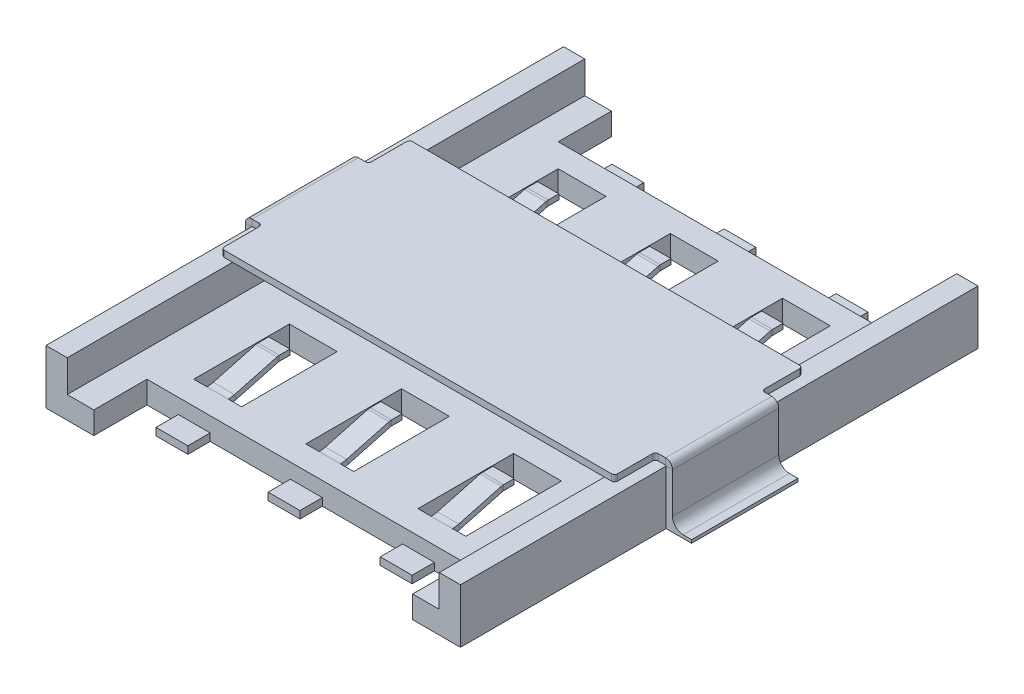
from build123d import *

# Parameters (mm, degrees)
SKETCH1_W           = 9.906
SKETCH1_H           = 12.3698
BOSS_EXTRUDE1_DEPTH = 0.5334
SKETCH2_W           = 0.508
SKETCH2_H           = 12.3698
BOSS_EXTRUDE2_DEPTH = 0.762
CUT_EXTRUDE1_REACH  = 9.96
SKETCH3_W           = 7.62
SKETCH3_H           = 1.27
CUT_EXTRUDE2_REACH  = 9.96
SKETCH4_W           = 1.143
SKETCH4_H           = 2.286
SKETCH5_W           = 0.1524
SKETCH5_H           = 2.54
SKETCH7_W           = 9.398
SKETCH7_H           = 0.9779
BOSS_EXTRUDE3_DEPTH = 0.1524
FILLET1_R           = 0.0762
SKETCH8_W           = 0.508
SKETCH8_H           = 0.127
SKETCH10_W          = 0.508
SKETCH10_H          = 0.127
SKETCH11_W          = 0.762
SKETCH11_H          = 0.5334
BOSS_EXTRUDE4_DEPTH = 0.1778
SKETCH12_W          = 0.4572
SKETCH12_H          = 2.54
BOSS_EXTRUDE5_DEPTH = 0.0762
FILLET2_R           = 0.254


with BuildPart() as part:
    # Sketch1 → Boss-Extrude1 (new body)
    with BuildSketch(Plane(origin=(0, 0, 0), x_dir=(1, 0, 0), z_dir=(0, 1, 0))):
        Rectangle(SKETCH1_W, SKETCH1_H)
    extrude(amount=BOSS_EXTRUDE1_DEPTH)

    # Sketch2 → Boss-Extrude2 (add)
    with BuildSketch(Plane(origin=(0, 0.5334, 0), x_dir=(1, 0, 0), z_dir=(0, 1, 0))):
        with Locations((-4.699, 0)):
            Rectangle(SKETCH2_W, SKETCH2_H)
        with Locations((4.699, 0)):
            Rectangle(SKETCH2_W, SKETCH2_H)
    extrude(amount=BOSS_EXTRUDE2_DEPTH)

    # Sketch3 → Cut-Extrude1 (cut, up to next)
    with BuildSketch(Plane(origin=(0, 0.5334, 0), x_dir=(1, 0, 0), z_dir=(0, 1, 0)), mode=Mode.PRIVATE) as cut_extrude1_sk1:
        with Locations((0, 5.5499)):
            Rectangle(SKETCH3_W, SKETCH3_H)
    cut_extrude1_tool1 = extrude(cut_extrude1_sk1.sketch, amount=-CUT_EXTRUDE1_REACH, mode=Mode.PRIVATE) & part.part
    # Sketch3 → Cut-Extrude1 (cut, up to next)
    with BuildSketch(Plane(origin=(0, 0.5334, 0), x_dir=(1, 0, 0), z_dir=(0, 1, 0)), mode=Mode.PRIVATE) as cut_extrude1_sk2:
        with Locations((0, -5.5499)):
            Rectangle(SKETCH3_W, SKETCH3_H)
    cut_extrude1_tool2 = extrude(cut_extrude1_sk2.sketch, amount=-CUT_EXTRUDE1_REACH, mode=Mode.PRIVATE) & part.part
    add(cut_extrude1_tool1.solids().sort_by_distance((0, 0.5334, -5.5499))[0], mode=Mode.SUBTRACT)
    add(cut_extrude1_tool2.solids().sort_by_distance((0, 0.5334, 5.5499))[0], mode=Mode.SUBTRACT)

    # Sketch4 → Cut-Extrude2 (cut, up to next)
    with BuildSketch(Plane(origin=(0, 0.5334, 0), x_dir=(1, 0, 0), z_dir=(0, 1, 0)), mode=Mode.PRIVATE) as cut_extrude2_sk1:
        with Locations((-2.6797, 3.2131)):
            Rectangle(SKETCH4_W, SKETCH4_H)
    cut_extrude2_tool1 = extrude(cut_extrude2_sk1.sketch, amount=-CUT_EXTRUDE2_REACH, mode=Mode.PRIVATE) & part.part
    # Sketch4 → Cut-Extrude2 (cut, up to next)
    with BuildSketch(Plane(origin=(0, 0.5334, 0), x_dir=(1, 0, 0), z_dir=(0, 1, 0)), mode=Mode.PRIVATE) as cut_extrude2_sk2:
        with Locations((0, 3.2131)):
            Rectangle(SKETCH4_W, SKETCH4_H)
    cut_extrude2_tool2 = extrude(cut_extrude2_sk2.sketch, amount=-CUT_EXTRUDE2_REACH, mode=Mode.PRIVATE) & part.part
    # Sketch4 → Cut-Extrude2 (cut, up to next)
    with BuildSketch(Plane(origin=(0, 0.5334, 0), x_dir=(1, 0, 0), z_dir=(0, 1, 0)), mode=Mode.PRIVATE) as cut_extrude2_sk3:
        with Locations((2.6797, 3.2131)):
            Rectangle(SKETCH4_W, SKETCH4_H)
    cut_extrude2_tool3 = extrude(cut_extrude2_sk3.sketch, amount=-CUT_EXTRUDE2_REACH, mode=Mode.PRIVATE) & part.part
    # Sketch4 → Cut-Extrude2 (cut, up to next)
    with BuildSketch(Plane(origin=(0, 0.5334, 0), x_dir=(1, 0, 0), z_dir=(0, 1, 0)), mode=Mode.PRIVATE) as cut_extrude2_sk4:
        with Locations((2.6797, -3.2131)):
            Rectangle(SKETCH4_W, SKETCH4_H)
    cut_extrude2_tool4 = extrude(cut_extrude2_sk4.sketch, amount=-CUT_EXTRUDE2_REACH, mode=Mode.PRIVATE) & part.part
    # Sketch4 → Cut-Extrude2 (cut, up to next)
    with BuildSketch(Plane(origin=(0, 0.5334, 0), x_dir=(1, 0, 0), z_dir=(0, 1, 0)), mode=Mode.PRIVATE) as cut_extrude2_sk5:
        with Locations((0, -3.2131)):
            Rectangle(SKETCH4_W, SKETCH4_H)
    cut_extrude2_tool5 = extrude(cut_extrude2_sk5.sketch, amount=-CUT_EXTRUDE2_REACH, mode=Mode.PRIVATE) & part.part
    # Sketch4 → Cut-Extrude2 (cut, up to next)
    with BuildSketch(Plane(origin=(0, 0.5334, 0), x_dir=(1, 0, 0), z_dir=(0, 1, 0)), mode=Mode.PRIVATE) as cut_extrude2_sk6:
        with Locations((-2.6797, -3.2131)):
            Rectangle(SKETCH4_W, SKETCH4_H)
    cut_extrude2_tool6 = extrude(cut_extrude2_sk6.sketch, amount=-CUT_EXTRUDE2_REACH, mode=Mode.PRIVATE) & part.part
    add(cut_extrude2_tool1.solids().sort_by_distance((-2.6797, 0.5334, -3.2131))[0], mode=Mode.SUBTRACT)
    add(cut_extrude2_tool2.solids().sort_by_distance((0, 0.5334, -3.2131))[0], mode=Mode.SUBTRACT)
    add(cut_extrude2_tool3.solids().sort_by_distance((2.6797, 0.5334, -3.2131))[0], mode=Mode.SUBTRACT)
    add(cut_extrude2_tool4.solids().sort_by_distance((2.6797, 0.5334, 3.2131))[0], mode=Mode.SUBTRACT)
    add(cut_extrude2_tool5.solids().sort_by_distance((0, 0.5334, 3.2131))[0], mode=Mode.SUBTRACT)
    add(cut_extrude2_tool6.solids().sort_by_distance((-2.6797, 0.5334, 3.2131))[0], mode=Mode.SUBTRACT)

    # Sweep1: sweep along a path in Sketch6
    with BuildLine(Plane.XY) as sweep1_path:
        Line((4.953, 0), (4.953, 1.2954))
        ThreePointArc((4.953, 1.2954), (4.949280256, 1.304380256), (4.9403, 1.3081))
        Line((4.9403, 1.3081), (-4.9403, 1.3081))
        ThreePointArc((-4.9403, 1.3081), (-4.949280256, 1.304380256), (-4.953, 1.2954))
        Line((-4.953, 1.2954), (-4.953, 0))
    # Sketch5 → Sweep1 (sweep)
    with BuildSketch(Plane.XZ):
        with Locations((5.0292, 0)):
            Rectangle(SKETCH5_W, SKETCH5_H)
    sweep(path=sweep1_path.line)

    # Sketch7 → Boss-Extrude3 (add)
    with BuildSketch(Plane(origin=(0, 1.4605, 0), x_dir=(1, 0, 0), z_dir=(0, 1, 0))):
        with Locations((0, -1.75895)):
            Rectangle(SKETCH7_W, SKETCH7_H)
        with Locations((0, 1.75895)):
            Rectangle(SKETCH7_W, SKETCH7_H)
    extrude(amount=-BOSS_EXTRUDE3_DEPTH)

    # Fillet1
    fillet1_edges = [part.edges().sort_by_distance(p)[0] for p in [
        (-4.699, 1.3843, 1.27),
        (-4.699, 1.3843, 2.2479),
        (4.699, 1.3843, 2.2479),
        (4.699, 1.3843, 1.27),
        (4.699, 1.3843, -1.27),
        (4.699, 1.3843, -2.2479),
        (-4.699, 1.3843, -2.2479),
        (-4.699, 1.3843, -1.27),
    ]]
    fillet(fillet1_edges, radius=FILLET1_R)

    # Sweep2: sweep along a path in Sketch9
    with BuildLine(Plane(origin=(0, 0, 0), x_dir=(0, 0, -1), z_dir=(1, 0, 0))) as sweep2_path:
        Line((3.544831516, 0.832589795), (3.290831516, 0.832589795))
        ThreePointArc((3.290831516, 0.832589795), (3.263130546, 0.830774177), (3.235903548, 0.825358391))
        Line((3.235903548, 0.825358391), (2.219903548, 0.553122011))
        ThreePointArc((2.219903548, 0.553122011), (2.145648098, 0.538351684), (2.0701, 0.5334))
    # Sketch8 → Sweep2 (sweep)
    with BuildSketch(Plane(origin=(0, 0, -2.0701), x_dir=(-1, 0, 0), z_dir=(0, 0, -1))):
        with Locations((0, 0.4699)):
            Rectangle(SKETCH8_W, SKETCH8_H)
        with Locations((2.6797, 0.4699)):
            Rectangle(SKETCH8_W, SKETCH8_H)
        with Locations((-2.6797, 0.4699)):
            Rectangle(SKETCH8_W, SKETCH8_H)
    sweep(path=sweep2_path.line)

    # Sweep3: sweep along a path in Sketch9<3>
    with BuildLine(Plane(origin=(0, 0, 0), x_dir=(0, 0, -1), z_dir=(1, 0, 0))) as sweep3_path:
        Line((-2.881368484, 0.832589795), (-3.135368484, 0.832589795))
        ThreePointArc((-3.135368484, 0.832589795), (-3.163069454, 0.830774177), (-3.190296452, 0.825358391))
        Line((-3.190296452, 0.825358391), (-4.206296452, 0.553122011))
        ThreePointArc((-4.206296452, 0.553122011), (-4.280551902, 0.538351684), (-4.3561, 0.5334))
    # Sketch10 → Sweep3 (sweep)
    with BuildSketch(Plane(origin=(0, 0, 4.3561), x_dir=(-1, 0, 0), z_dir=(0, 0, -1))):
        with Locations((0, 0.4699)):
            Rectangle(SKETCH10_W, SKETCH10_H)
        with Locations((-2.6797, 0.4699)):
            Rectangle(SKETCH10_W, SKETCH10_H)
        with Locations((2.6797, 0.4699)):
            Rectangle(SKETCH10_W, SKETCH10_H)
    sweep(path=sweep3_path.line)

    # Sketch11 → Boss-Extrude4 (add)
    with BuildSketch(Plane.XZ):
        with Locations((-2.6797, -5.1816)):
            Rectangle(SKETCH11_W, SKETCH11_H)
        with Locations((0, -5.1816)):
            Rectangle(SKETCH11_W, SKETCH11_H)
        with Locations((2.6797, -5.1816)):
            Rectangle(SKETCH11_W, SKETCH11_H)
    boss_extrude4 = extrude(amount=-BOSS_EXTRUDE4_DEPTH)

    # Mirror1: Boss-Extrude4 across plane
    add(boss_extrude4.mirror(Plane.XY))

    # Sketch12 → Boss-Extrude5 (add)
    with BuildSketch(Plane.XZ):
        with Locations((5.334, 0)):
            Rectangle(SKETCH12_W, SKETCH12_H)
    boss_extrude5 = extrude(amount=-BOSS_EXTRUDE5_DEPTH)

    # Mirror4: Boss-Extrude5 across plane
    add(boss_extrude5.mirror(Plane(origin=(0, 0, 0), x_dir=(0, 0, 1), z_dir=(1, 0, 0))))

    # Fillet2
    fillet2_edges = [part.edges().sort_by_distance(p)[0] for p in [
        (-5.1054, 0.0762, 0),
        (5.1054, 0.0762, 0),
    ]]
    fillet(fillet2_edges, radius=FILLET2_R)


solid = part.part
